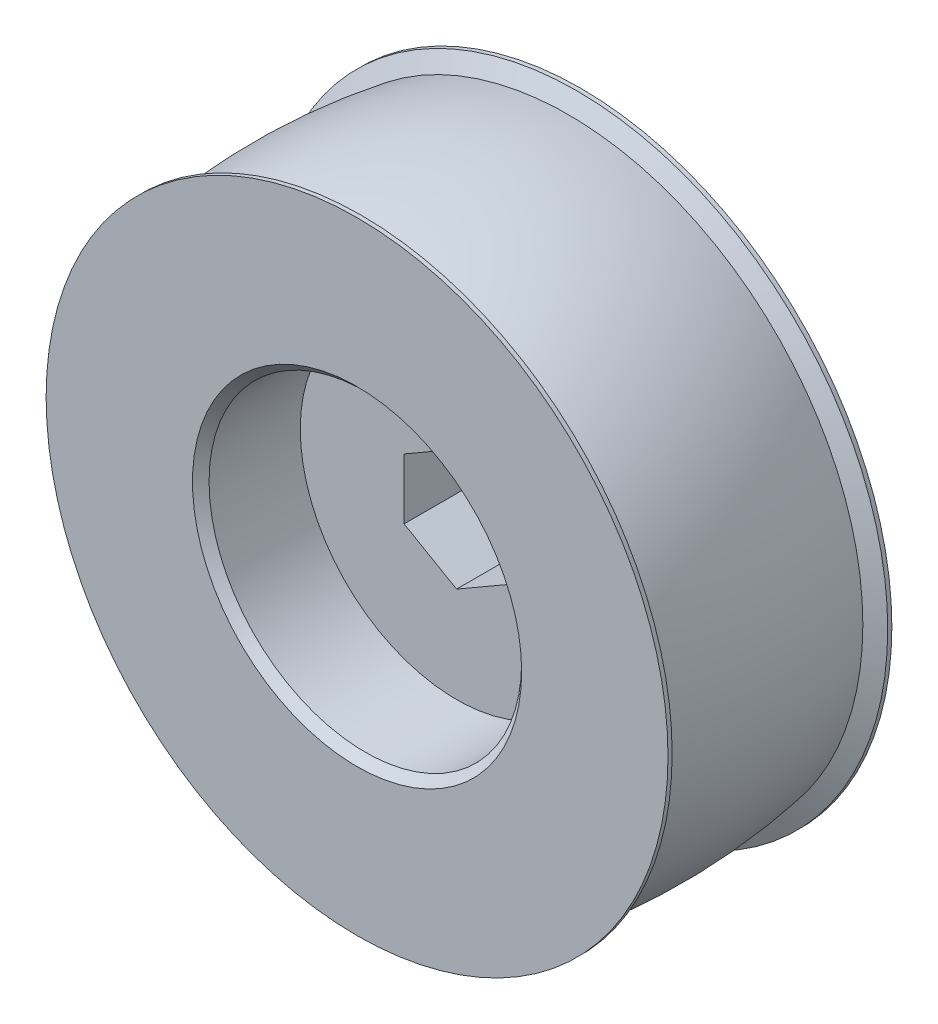
from build123d import *

# Parameters (mm, degrees)
ESQUISSE1_R             = 37.5
ESQUISSE1_R_2           = 2.15
BOSS_EXTRU_1_DEPTH      = 15
ESQUISSE2_R             = 37.5
ESQUISSE2_R_2           = 18.85
BOSS_EXTRU_2_DEPTH      = 12
ENL_V_MAT_EXTRU_9_DEPTH = 13
CHANFREIN1_SIZE         = 1


with BuildPart() as part:
    # Esquisse1 → Boss.-Extru.1 (new body)
    with BuildSketch(Plane.XY):
        Circle(ESQUISSE1_R)
        Circle(ESQUISSE1_R_2, mode=Mode.SUBTRACT)
    extrude(amount=BOSS_EXTRU_1_DEPTH)

    # Esquisse2 → Boss.-Extru.2 (add)
    with BuildSketch(Plane.XY.offset(15)):
        Circle(ESQUISSE2_R)
        Circle(ESQUISSE2_R_2, mode=Mode.SUBTRACT)
    extrude(amount=BOSS_EXTRU_2_DEPTH)

    # Esquisse9 → Enlèv. mat.-Extru.9 (cut)
    with BuildSketch(Plane.XY.offset(15)):
        Polygon((6.325, -3.651740453), (6.325, 3.651740453), (0, 7.303480905), (-6.325, 3.651740453), (-6.325, -3.651740453), (0, -7.303480905), align=None)
    extrude(amount=-ENL_V_MAT_EXTRU_9_DEPTH, mode=Mode.SUBTRACT)

    # Chanfrein1
    chanfrein1_edges = [part.edges().sort_by_distance(p)[0] for p in [
        (-18.85, 0, 27),
    ]]
    chamfer(chanfrein1_edges, length=CHANFREIN1_SIZE)

    # Esquisse10 → Enlèvement de matière-Révolution1 (revolve, cut)
    with BuildSketch(Plane(origin=(0, 0, 0), x_dir=(0, 0, -1), z_dir=(1, 0, 0)), mode=Mode.PRIVATE) as enl_vement_de_mati_re_r_volution1_sk:
        with BuildLine():
            Line((-26.5, 37.5), (-0.5, 37.5))
            Line((-0.5, 37.5), (-1.5, 35.5))
            ThreePointArc((-1.5, 35.5), (-13.5, 36.5), (-25.5, 35.5))
            Line((-25.5, 35.5), (-26.5, 37.5))
        make_face()
    revolve(enl_vement_de_mati_re_r_volution1_sk.sketch.rotate(Axis((0, 0, 0), (0, 0, 1)), 90), axis=Axis((0, 0, 0), (0, 0, 1)), mode=Mode.SUBTRACT)


solid = part.part
